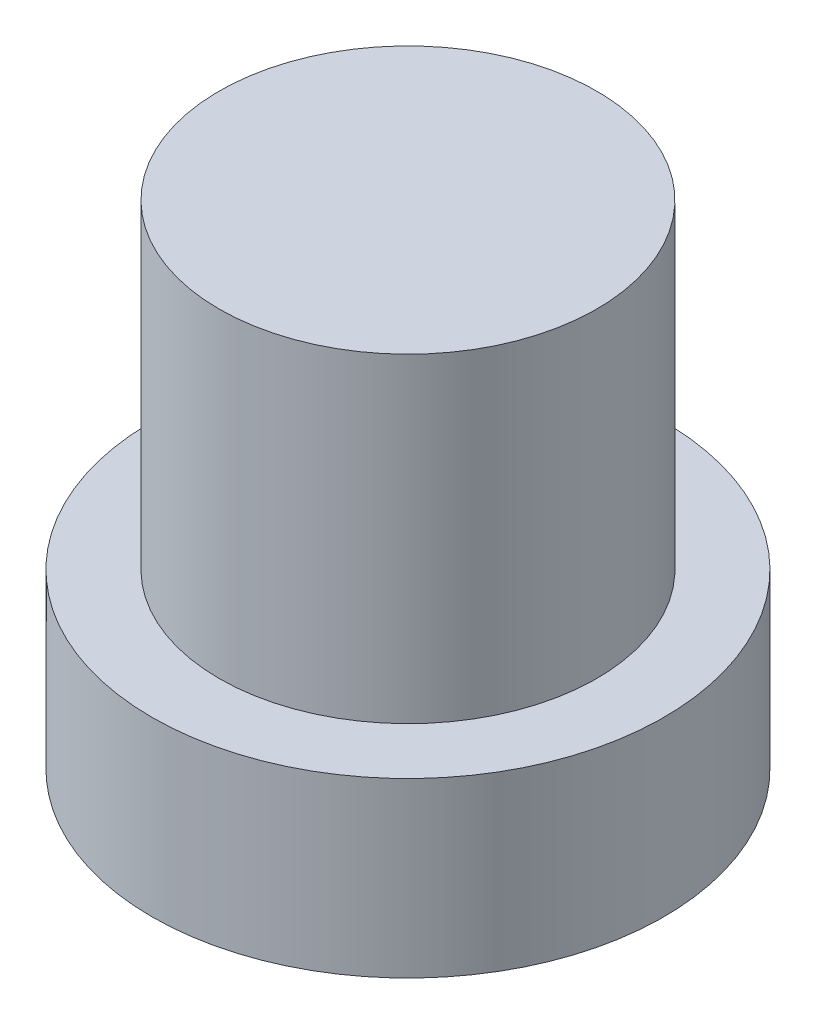
from build123d import *

# Parameters (mm, degrees)
SKETCH_1_R      = 4
SKETCH_1_R_2    = 3
EXTRUDE_1_DEPTH = 2.4
SKETCH_2_R      = 4
EXTRUDE_2_DEPTH = 0.3
SKETCH_3_R      = 2.95
EXTRUDE_3_DEPTH = 5


with BuildPart() as part:
    # 草图1 → 凸台-拉伸1 (new body)
    with BuildSketch(Plane(origin=(0, 0, 0), x_dir=(1, 0, 0), z_dir=(0, 1, 0))):
        with Locations(Location((0, 0, 0), (0, 0, 270))):
            Circle(SKETCH_1_R)
        with Locations(Location((0, 0, 0), (0, 0, 270))):
            Circle(SKETCH_1_R_2, mode=Mode.SUBTRACT)
    extrude(amount=EXTRUDE_1_DEPTH)

    # 草图2 → 凸台-拉伸2 (add)
    with BuildSketch(Plane(origin=(0, 2.4, 0), x_dir=(1, 0, 0), z_dir=(0, 1, 0))):
        with Locations(Location((0, 0, 0), (0, 0, 270))):
            Circle(SKETCH_2_R)
    extrude(amount=EXTRUDE_2_DEPTH)

    # 草图3 → 凸台-拉伸3 (add)
    with BuildSketch(Plane(origin=(0, 2.7, 0), x_dir=(1, 0, 0), z_dir=(0, 1, 0))):
        with Locations(Location((0, 0, 0), (0, 0, 270))):
            Circle(SKETCH_3_R)
    extrude(amount=EXTRUDE_3_DEPTH)


solid = part.part
